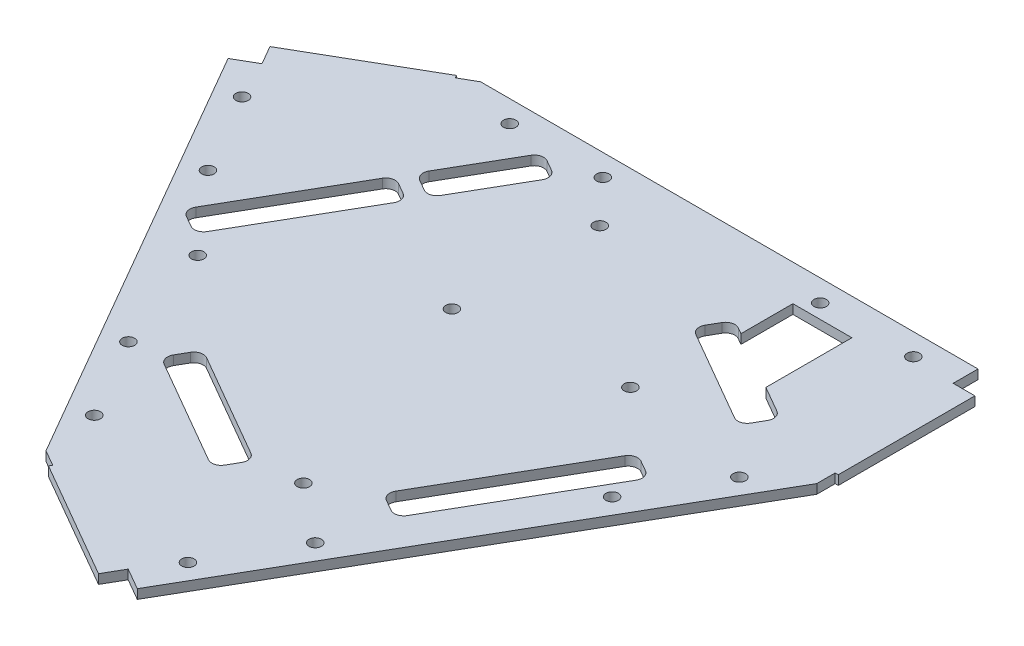
from build123d import *

# Parameters (mm, degrees)
EXTRUSION1_DEPTH         = 3
ENL_V_MAT_EXTRU_14_REACH = 176.1
ESQUISSE8_R              = 2
ESQUISSE10_R             = 2
ENL_V_MAT_EXTRU_16_DEPTH = 175.099861741
ENL_V_MAT_EXTRU_17_DEPTH = 175.099861741
ENL_V_MAT_EXTRU_18_DEPTH = 167.529952384
CONG_1_R                 = 3


with BuildPart() as part:
    # Esquisse1 → Extrusion1 (new body)
    with BuildSketch(Plane(origin=(0, 0, 0), x_dir=(1, 0, 0), z_dir=(0, 1, 0))):
        Polygon((-64.179491924, 79.940798285), (98.820508076, 79.940798285), (103.820508076, 74.940798285), (103.820508076, 24.940798285), (101.320508076, 15.610671266), (19.820508076, -125.551469551), (12.990381057, -127.38159657), (-30.310889132, -102.38159657), (-37.141016151, -95.551469551), (-118.641016151, 45.610671266), (-116.810889132, 52.440798285), (-73.509618943, 77.440798285), align=None)
    extrude(amount=EXTRUSION1_DEPTH)

    # Esquisse8 → Enlèv. mat.-Extru.14 (cut, up to next)
    with BuildSketch(Plane(origin=(0, 3, 0), x_dir=(1, 0, 0), z_dir=(0, 1, 0)), mode=Mode.PRIVATE) as enl_v_mat_extru_14_sk1:
        with Locations(Location((-100.570508076, 34.31163316, 0), (0, 0, 270))):
            Circle(ESQUISSE8_R)
    enl_v_mat_extru_14_tool1 = extrude(enl_v_mat_extru_14_sk1.sketch, amount=-ENL_V_MAT_EXTRU_14_REACH, mode=Mode.PRIVATE) & part.part
    # Esquisse8 → Enlèv. mat.-Extru.14 (cut, up to next)
    with BuildSketch(Plane(origin=(0, 3, 0), x_dir=(1, 0, 0), z_dir=(0, 1, 0)), mode=Mode.PRIVATE) as enl_v_mat_extru_14_sk2:
        with Locations(Location((80, 69.940798285, 0), (0, 0, 270))):
            Circle(ESQUISSE8_R)
    enl_v_mat_extru_14_tool2 = extrude(enl_v_mat_extru_14_sk2.sketch, amount=-ENL_V_MAT_EXTRU_14_REACH, mode=Mode.PRIVATE) & part.part
    # Esquisse8 → Enlèv. mat.-Extru.14 (cut, up to next)
    with BuildSketch(Plane(origin=(0, 3, 0), x_dir=(1, 0, 0), z_dir=(0, 1, 0)), mode=Mode.PRIVATE) as enl_v_mat_extru_14_sk3:
        with Locations(Location((50, 69.940798285, 0), (0, 0, 270))):
            Circle(ESQUISSE8_R)
    enl_v_mat_extru_14_tool3 = extrude(enl_v_mat_extru_14_sk3.sketch, amount=-ENL_V_MAT_EXTRU_14_REACH, mode=Mode.PRIVATE) & part.part
    # Esquisse8 → Enlèv. mat.-Extru.14 (cut, up to next)
    with BuildSketch(Plane(origin=(0, 3, 0), x_dir=(1, 0, 0), z_dir=(0, 1, 0)), mode=Mode.PRIVATE) as enl_v_mat_extru_14_sk4:
        with Locations(Location((-50.570508076, -52.290907218, 0), (0, 0, 270))):
            Circle(ESQUISSE8_R)
    enl_v_mat_extru_14_tool4 = extrude(enl_v_mat_extru_14_sk4.sketch, amount=-ENL_V_MAT_EXTRU_14_REACH, mode=Mode.PRIVATE) & part.part
    # Esquisse8 → Enlèv. mat.-Extru.14 (cut, up to next)
    with BuildSketch(Plane(origin=(0, 3, 0), x_dir=(1, 0, 0), z_dir=(0, 1, 0)), mode=Mode.PRIVATE) as enl_v_mat_extru_14_sk5:
        with Locations(Location((-35.570508076, -78.271669332, 0), (0, 0, 270))):
            Circle(ESQUISSE8_R)
    enl_v_mat_extru_14_tool5 = extrude(enl_v_mat_extru_14_sk5.sketch, amount=-ENL_V_MAT_EXTRU_14_REACH, mode=Mode.PRIVATE) & part.part
    # Esquisse8 → Enlèv. mat.-Extru.14 (cut, up to next)
    with BuildSketch(Plane(origin=(0, 3, 0), x_dir=(1, 0, 0), z_dir=(0, 1, 0)), mode=Mode.PRIVATE) as enl_v_mat_extru_14_sk6:
        with Locations(Location((-20, 69.940798285, 0), (0, 0, 270))):
            Circle(ESQUISSE8_R)
    enl_v_mat_extru_14_tool6 = extrude(enl_v_mat_extru_14_sk6.sketch, amount=-ENL_V_MAT_EXTRU_14_REACH, mode=Mode.PRIVATE) & part.part
    # Esquisse8 → Enlèv. mat.-Extru.14 (cut, up to next)
    with BuildSketch(Plane(origin=(0, 3, 0), x_dir=(1, 0, 0), z_dir=(0, 1, 0)), mode=Mode.PRIVATE) as enl_v_mat_extru_14_sk7:
        with Locations(Location((-50, 69.940798285, 0), (0, 0, 270))):
            Circle(ESQUISSE8_R)
    enl_v_mat_extru_14_tool7 = extrude(enl_v_mat_extru_14_sk7.sketch, amount=-ENL_V_MAT_EXTRU_14_REACH, mode=Mode.PRIVATE) & part.part
    # Esquisse8 → Enlèv. mat.-Extru.14 (cut, up to next)
    with BuildSketch(Plane(origin=(0, 3, 0), x_dir=(1, 0, 0), z_dir=(0, 1, 0)), mode=Mode.PRIVATE) as enl_v_mat_extru_14_sk8:
        with Locations(Location((20.570508076, -104.252431445, 0), (0, 0, 270))):
            Circle(ESQUISSE8_R)
    enl_v_mat_extru_14_tool8 = extrude(enl_v_mat_extru_14_sk8.sketch, amount=-ENL_V_MAT_EXTRU_14_REACH, mode=Mode.PRIVATE) & part.part
    # Esquisse8 → Enlèv. mat.-Extru.14 (cut, up to next)
    with BuildSketch(Plane(origin=(0, 3, 0), x_dir=(1, 0, 0), z_dir=(0, 1, 0)), mode=Mode.PRIVATE) as enl_v_mat_extru_14_sk9:
        with Locations(Location((35.570508076, -78.271669332, 0), (0, 0, 270))):
            Circle(ESQUISSE8_R)
    enl_v_mat_extru_14_tool9 = extrude(enl_v_mat_extru_14_sk9.sketch, amount=-ENL_V_MAT_EXTRU_14_REACH, mode=Mode.PRIVATE) & part.part
    # Esquisse8 → Enlèv. mat.-Extru.14 (cut, up to next)
    with BuildSketch(Plane(origin=(0, 3, 0), x_dir=(1, 0, 0), z_dir=(0, 1, 0)), mode=Mode.PRIVATE) as enl_v_mat_extru_14_sk10:
        with Locations(Location((-85.570508076, 8.330871047, 0), (0, 0, 270))):
            Circle(ESQUISSE8_R)
    enl_v_mat_extru_14_tool10 = extrude(enl_v_mat_extru_14_sk10.sketch, amount=-ENL_V_MAT_EXTRU_14_REACH, mode=Mode.PRIVATE) & part.part
    # Esquisse8 → Enlèv. mat.-Extru.14 (cut, up to next)
    with BuildSketch(Plane(origin=(0, 3, 0), x_dir=(1, 0, 0), z_dir=(0, 1, 0)), mode=Mode.PRIVATE) as enl_v_mat_extru_14_sk11:
        with Locations(Location((70.570508076, -17.649891067, 0), (0, 0, 270))):
            Circle(ESQUISSE8_R)
    enl_v_mat_extru_14_tool11 = extrude(enl_v_mat_extru_14_sk11.sketch, amount=-ENL_V_MAT_EXTRU_14_REACH, mode=Mode.PRIVATE) & part.part
    # Esquisse8 → Enlèv. mat.-Extru.14 (cut, up to next)
    with BuildSketch(Plane(origin=(0, 3, 0), x_dir=(1, 0, 0), z_dir=(0, 1, 0)), mode=Mode.PRIVATE) as enl_v_mat_extru_14_sk12:
        with Locations(Location((85.570508076, 8.330871047, 0), (0, 0, 270))):
            Circle(ESQUISSE8_R)
    enl_v_mat_extru_14_tool12 = extrude(enl_v_mat_extru_14_sk12.sketch, amount=-ENL_V_MAT_EXTRU_14_REACH, mode=Mode.PRIVATE) & part.part
    add(enl_v_mat_extru_14_tool1.solids().sort_by_distance((-100.570508, 3, -34.311633))[0], mode=Mode.SUBTRACT)
    add(enl_v_mat_extru_14_tool2.solids().sort_by_distance((80, 3, -69.940798))[0], mode=Mode.SUBTRACT)
    add(enl_v_mat_extru_14_tool3.solids().sort_by_distance((50, 3, -69.940798))[0], mode=Mode.SUBTRACT)
    add(enl_v_mat_extru_14_tool4.solids().sort_by_distance((-50.570508, 3, 52.290907))[0], mode=Mode.SUBTRACT)
    add(enl_v_mat_extru_14_tool5.solids().sort_by_distance((-35.570508, 3, 78.271669))[0], mode=Mode.SUBTRACT)
    add(enl_v_mat_extru_14_tool6.solids().sort_by_distance((-20, 3, -69.940798))[0], mode=Mode.SUBTRACT)
    add(enl_v_mat_extru_14_tool7.solids().sort_by_distance((-50, 3, -69.940798))[0], mode=Mode.SUBTRACT)
    add(enl_v_mat_extru_14_tool8.solids().sort_by_distance((20.570508, 3, 104.252431))[0], mode=Mode.SUBTRACT)
    add(enl_v_mat_extru_14_tool9.solids().sort_by_distance((35.570508, 3, 78.271669))[0], mode=Mode.SUBTRACT)
    add(enl_v_mat_extru_14_tool10.solids().sort_by_distance((-85.570508, 3, -8.330871))[0], mode=Mode.SUBTRACT)
    add(enl_v_mat_extru_14_tool11.solids().sort_by_distance((70.570508, 3, 17.649891))[0], mode=Mode.SUBTRACT)
    add(enl_v_mat_extru_14_tool12.solids().sort_by_distance((85.570508, 3, -8.330871))[0], mode=Mode.SUBTRACT)

    # Esquisse10 → Enlèv. mat.-Extru.16 (cut, through all)
    with BuildSketch(Plane(origin=(0, 3, 0), x_dir=(1, 0, 0), z_dir=(0, 1, 0))):
        with Locations(Location((-63.520181276, -17.020181276, 0), (0, 0, 270))):
            Circle(ESQUISSE10_R)
        with Locations(Location((17.020181276, -63.520181276, 0), (0, 0, 270))):
            Circle(ESQUISSE10_R)
        with Locations(Location((42.965884077, 15.839094213, 0), (0, 0, 270))):
            Circle(ESQUISSE10_R)
        with Locations(Location((-7.629221728, 8.965800345, 0), (0, 0, 270))):
            Circle(ESQUISSE10_R)
        with Locations(Location((-7.029145761, 55.985162408, 0), (0, 0, 270))):
            Circle(ESQUISSE10_R)
    extrude(amount=-ENL_V_MAT_EXTRU_16_DEPTH, mode=Mode.SUBTRACT)

    # Esquisse12 → Enlèv. mat.-Extru.17 (cut, through all)
    with BuildSketch(Plane(origin=(0, 3, 0), x_dir=(1, 0, 0), z_dir=(0, 1, 0))):
        Polygon((-30.310889132, -102.38159657), (12.990381057, -127.38159657), (19.820508076, -125.551469551), (101.320508076, 15.610671266), (103.820508076, 24.940798285), (103.820508076, 74.940798285), (98.820508076, 79.940798285), (-64.179491924, 79.940798285), (-73.509618943, 77.440798285), (-116.810889132, 52.440798285), (-118.641016151, 45.610671266), (-37.141016151, -95.551469551), align=None)
        Polygon((99.62141135, 18.66774941), (19.722431865, -119.721342532), (12.794228635, -115.721342532), (9.294228635, -121.783520358), (-28.810889132, -99.783520358), (-28.310889132, -98.917494954), (-33.444863728, -95.953393339), (-33.643960454, -95.608547695), (-113.54293994, 42.780544247), (-106.61473671, 46.780544247), (-110.11473671, 52.842722074), (-72.009618943, 74.842722074), (-71.509618943, 73.97669667), (-66.375644347, 76.940798285), (-65.977450895, 76.940798285), (93.820508076, 76.940798285), (93.820508076, 68.940798285), (100.820508076, 68.940798285), (100.820508076, 24.940798285), (99.820508076, 24.940798285), (99.820508076, 19.012595055), align=None, mode=Mode.SUBTRACT)
    extrude(amount=-ENL_V_MAT_EXTRU_17_DEPTH, mode=Mode.SUBTRACT)

    # Esquisse13 → Enlèv. mat.-Extru.18 (cut, through all)
    with BuildSketch(Plane(origin=(0, 3, 0), x_dir=(1, 0, 0), z_dir=(0, 1, 0))):
        Polygon((-70.131397208, -11.47114317), (-45.131397208, 31.830127019), (-53.791651246, 36.830127019), (-78.791651246, -6.47114317), align=None)
        Polygon((-51.291651246, 41.160254038), (-36.291651246, 67.141016151), (-27.631397208, 62.141016151), (-42.631397208, 36.160254038), align=None)
        Polygon((32.631397208, -53.480762114), (62.631397208, -1.519237886), (71.291651246, -6.519237886), (41.291651246, -58.480762114), align=None)
        Polygon((70.801270189, 22.631397208), (36.160254038, 42.631397208), (41.160254038, 51.291651246), (45.803878216, 48.610653577), (45.803878216, 65.342402688), (64.803878216, 65.342402688), (64.803878216, 46.342402688), (64.803878216, 37.640998462), (75.801270189, 31.291651246), align=None)
        Polygon((2.810889132, -65.131397208), (-36.160254038, -42.631397208), (-41.160254038, -51.291651246), (-2.189110868, -73.791651246), align=None)
    extrude(amount=-ENL_V_MAT_EXTRU_18_DEPTH, mode=Mode.SUBTRACT)

    # Congé1
    cong_1_edges = [part.edges().sort_by_distance(p)[0] for p in [
        (-70.131397208, 1.5, 11.47114317),
        (-78.791651246, 1.5, 6.47114317),
        (-53.791651246, 1.5, -36.830127019),
        (-45.131397208, 1.5, -31.830127019),
        (2.810889132, 1.5, 65.131397208),
        (-2.189110868, 1.5, 73.791651246),
        (-41.160254038, 1.5, 51.291651246),
        (-36.160254038, 1.5, 42.631397208),
        (75.801270189, 1.5, -31.291651246),
        (70.801270189, 1.5, -22.631397208),
        (36.160254038, 1.5, -42.631397208),
        (41.160254038, 1.5, -51.291651246),
        (71.291651246, 1.5, 6.519237886),
        (41.291651246, 1.5, 58.480762114),
        (32.631397208, 1.5, 53.480762114),
        (62.631397208, 1.5, 1.519237886),
        (-42.631397208, 1.5, -36.160254038),
        (-51.291651246, 1.5, -41.160254038),
        (-36.291651246, 1.5, -67.141016151),
        (-27.631397208, 1.5, -62.141016151),
    ]]
    fillet(cong_1_edges, radius=CONG_1_R)


solid = part.part
